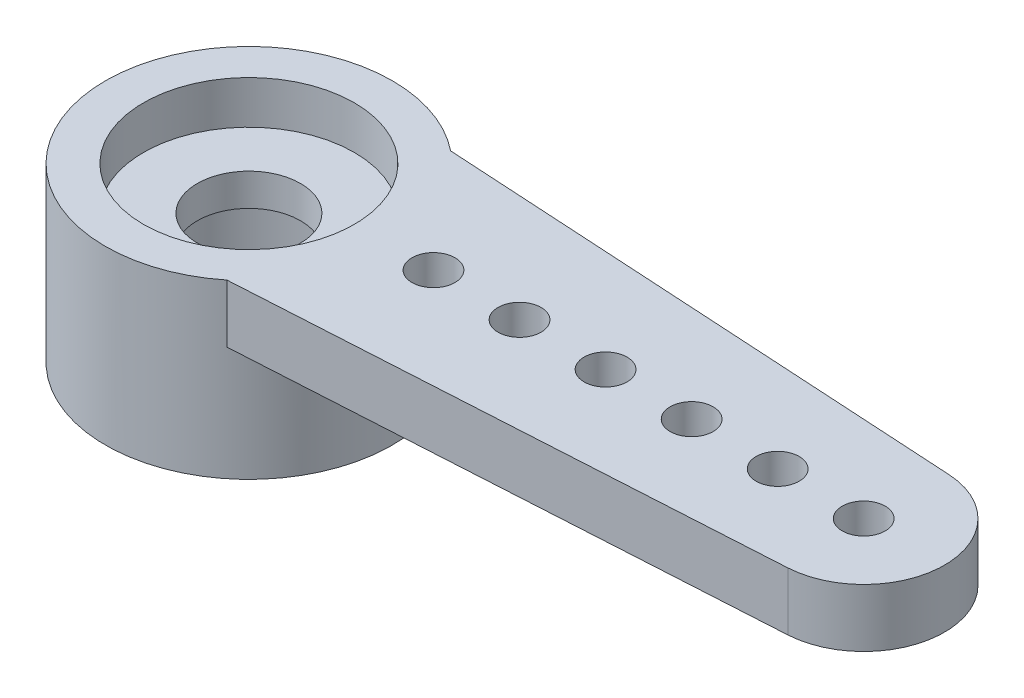
from build123d import *

# Parameters (mm, degrees)
BOSS_EXTRUDE1_START = -1.35
SKETCH3_R           = 0.5
BOSS_EXTRUDE1_DEPTH = 1.35


with BuildPart() as part:
    # Sketch2 → Revolve1 (revolve)
    with BuildSketch(Plane.XY, mode=Mode.PRIVATE) as revolve1_sk:
        Polygon((2.45, 0), (2.45, 2.25), (1.2, 2.25), (1.2, 3), (2.45, 3), (2.45, 4), (3.335, 4), (3.335, 0), align=None)
    revolve(revolve1_sk.sketch.rotate(Axis((0, 0, 0), (0, 1, 0)), 90), axis=Axis((0, 0, 0), (0, 1, 0)))

    # Sketch3 → Boss-Extrude1 (add)
    with BuildSketch(Plane(origin=(0, 4, 0), x_dir=(1, 0, 0), z_dir=(0, 1, 0)).offset(BOSS_EXTRUDE1_START)):
        with BuildLine():
            Line((2.088594025, 2.6), (14.400412206, 1.875))
            ThreePointArc((14.400412206, 1.875), (16.168248081, 0), (14.400412206, -1.875))
            Line((14.400412206, -1.875), (2.088594025, -2.6))
            ThreePointArc((2.088594025, -2.6), (3.335, 0), (2.088594025, 2.6))
        make_face()
        with Locations(Location((14.29, 0, 0), (0, 0, 270))):
            Circle(SKETCH3_R, mode=Mode.SUBTRACT)
        with Locations(Location((12.29, 0, 0), (0, 0, 270))):
            Circle(SKETCH3_R, mode=Mode.SUBTRACT)
        with Locations(Location((10.29, 0, 0), (0, 0, 270))):
            Circle(SKETCH3_R, mode=Mode.SUBTRACT)
        with Locations(Location((8.29, 0, 0), (0, 0, 270))):
            Circle(SKETCH3_R, mode=Mode.SUBTRACT)
        with Locations(Location((6.29, 0, 0), (0, 0, 270))):
            Circle(SKETCH3_R, mode=Mode.SUBTRACT)
        with Locations(Location((4.29, 0, 0), (0, 0, 270))):
            Circle(SKETCH3_R, mode=Mode.SUBTRACT)
    extrude(amount=BOSS_EXTRUDE1_DEPTH)


solid = part.part
